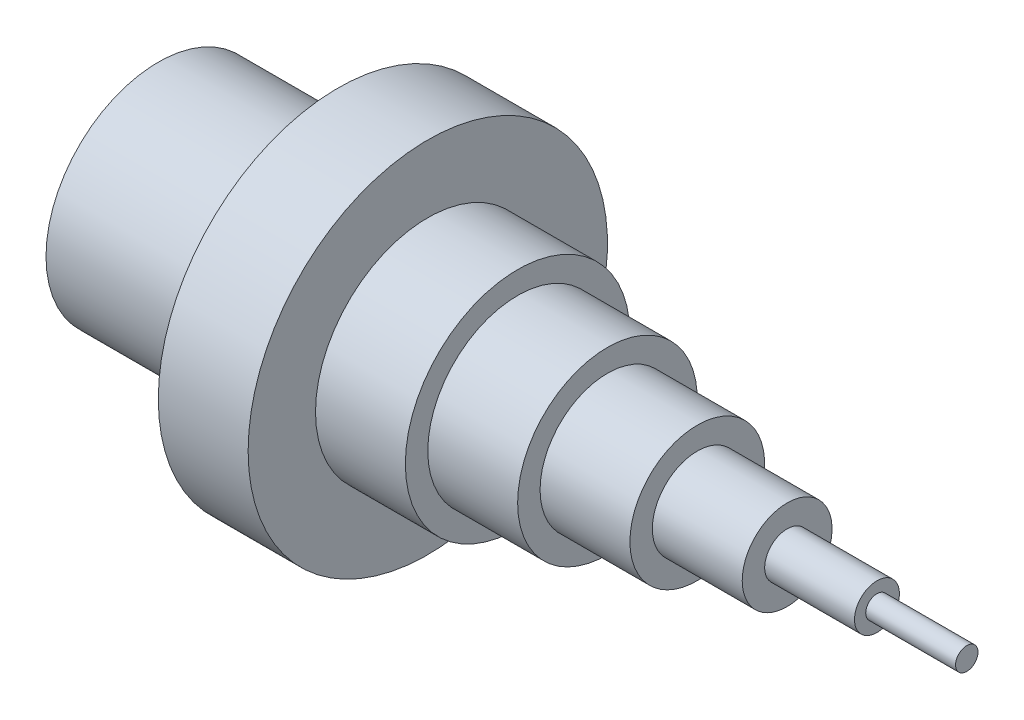
from build123d import *

# Parameters (mm, degrees)
CROQUIS2_R            = 20
CORTAR_EXTRUIR2_DEPTH = 40


with BuildPart() as part:
    # Croquis1 → Revolución1 (revolve)
    with BuildSketch(Plane.XY, mode=Mode.PRIVATE) as revoluci_n1_sk:
        Polygon((0, 0), (0, 2.5), (-20, 2.5), (-20, 5), (-40, 5), (-40, 10), (-60, 10), (-60, 15), (-80, 15), (-80, 20), (-100, 20), (-100, 25), (-120, 25), (-120, 40), (-140, 40), (-140, 25), (-180, 25), (-180, 0), align=None)
    revolve(revoluci_n1_sk.sketch.rotate(Axis((-180, 0, 0), (1, 0, 0)), 90), axis=Axis((-180, 0, 0), (1, 0, 0)))

    # Croquis2 → Cortar-Extruir2 (cut)
    with BuildSketch(Plane.ZY.offset(180)):
        Circle(CROQUIS2_R)
    extrude(amount=-CORTAR_EXTRUIR2_DEPTH, mode=Mode.SUBTRACT)


solid = part.part
